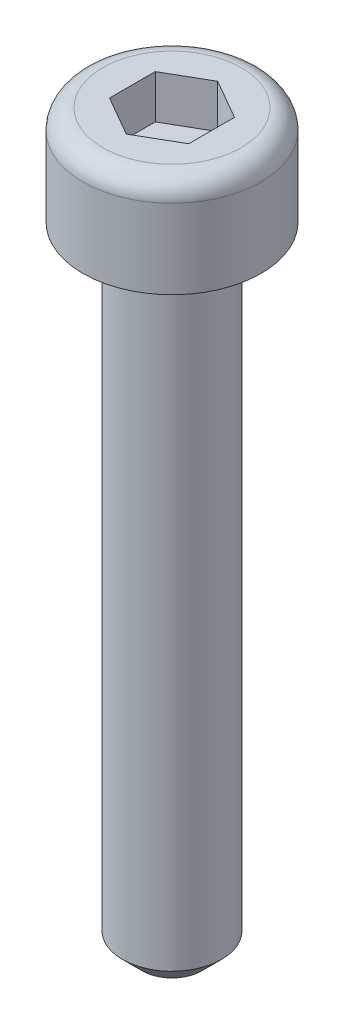
from build123d import *

# Parameters (mm, degrees)
CORTAR_EXTRUIR1_DEPTH = 1.1
CHAFL_N1_SIZE         = 0.5
REDONDEO1_R           = 0.5


with BuildPart() as part:
    # Croquis1 → Revolución1 (revolve)
    with BuildSketch(Plane.XY, mode=Mode.PRIVATE) as revoluci_n1_sk:
        Polygon((0, 0), (2.25, 0), (2.25, -2.5), (1.25, -2.5), (1.25, -18.5), (0, -18.5), align=None)
    revolve(revoluci_n1_sk.sketch.rotate(Axis((0, 0, 0), (0, -1, 0)), 90), axis=Axis((0, 0, 0), (0, -1, 0)))

    # Croquis2 → Cortar-Extruir1 (cut)
    with BuildSketch(Plane(origin=(0, 0, 0), x_dir=(1, 0, 0), z_dir=(0, 1, 0))):
        Polygon((1, 0.577350269), (0, 1.154700538), (-1, 0.577350269), (-1, -0.577350269), (0, -1.154700538), (1, -0.577350269), align=None)
    extrude(amount=-CORTAR_EXTRUIR1_DEPTH, mode=Mode.SUBTRACT)

    # Chaflán1
    chafl_n1_edges = [part.edges().sort_by_distance(p)[0] for p in [
        (0, -18.5, -1.25),
    ]]
    chamfer(chafl_n1_edges, length=CHAFL_N1_SIZE)

    # Redondeo1
    redondeo1_edges = [part.edges().sort_by_distance(p)[0] for p in [
        (0, 0, -2.25),
    ]]
    fillet(redondeo1_edges, radius=REDONDEO1_R)


solid = part.part
